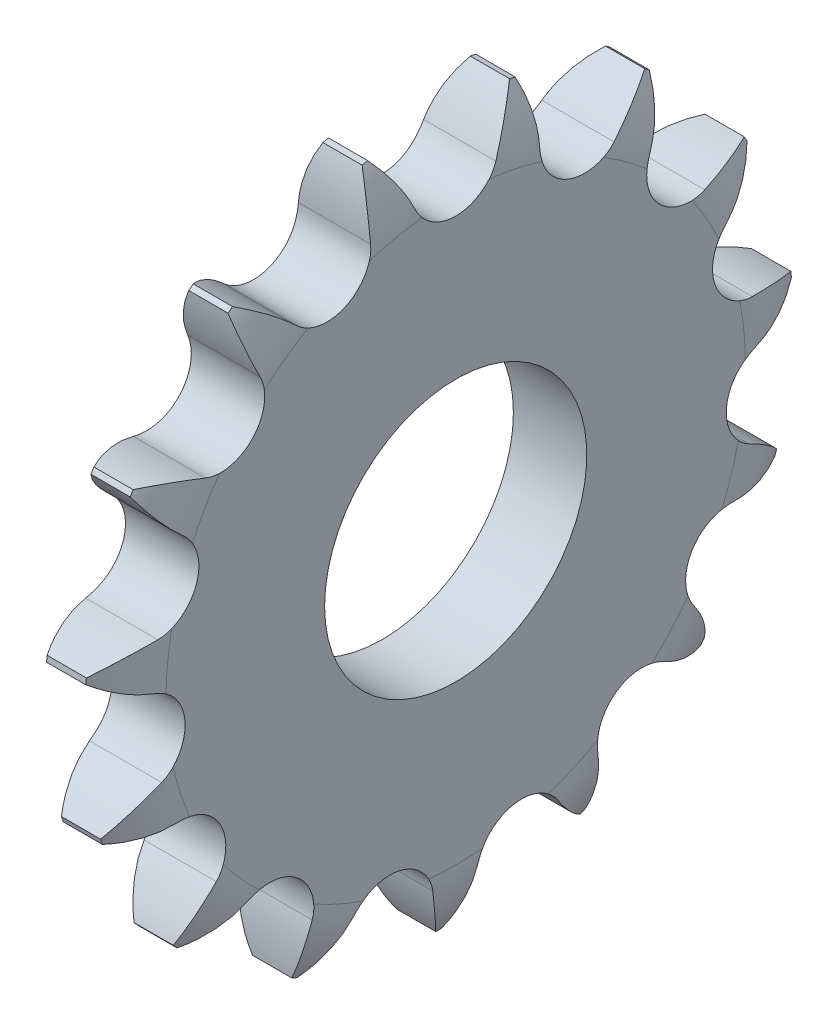
from build123d import *

# Parameters (mm, degrees)
TOOTHCUT_DEPTH  = 37.710811315
TEETHCUTS_COUNT = 15
TEETHCUTS_ANGLE = 336
BORSKE_R        = 9.5
BORE_DEPTH      = 50.0005


with BuildPart() as part:
    # BasProSke → Base-Revolve (revolve)
    with BuildSketch(Plane(origin=(0, 0, 0), x_dir=(1, 0, 0), z_dir=(0, 1, 0)), mode=Mode.PRIVATE) as base_revolve_sk:
        with BuildLine():
            Line((0, 0), (0, 20.988608354))
            ThreePointArc((0, 20.988608354), (0.314698702, 23.416771239), (1.238, 25.684484843))
            Line((1.238, 25.684484843), (4.0816, 25.684484843))
            ThreePointArc((4.0816, 25.684484843), (5.004901298, 23.416771239), (5.3196, 20.988608354))
            Line((5.3196, 20.988608354), (5.3196, 0))
            Line((5.3196, 0), (0, 0))
        make_face()
    revolve(base_revolve_sk.sketch.rotate(Axis((-10, 0, 0), (1, 0, 0)), 180), axis=Axis((-10, 0, 0), (1, 0, 0)))

    # TooCutSke → ToothCut (cut, through all)
    with BuildSketch(Plane(origin=(0, 0, 0), x_dir=(0, 0, -1), z_dir=(1, 0, 0))):
        with BuildLine():
            ThreePointArc((2.951828939, 21.685132796), (4.063020217, 23.756940993), (5.530366998, 25.593793922))
            ThreePointArc((5.530366998, 25.593793922), (0, 26.184484843), (-5.530366998, 25.593793922))
            ThreePointArc((-5.530366998, 25.593793922), (-4.063020217, 23.756940993), (-2.951828939, 21.685132796))
            ThreePointArc((-2.951828939, 21.685132796), (0, 19.731359843), (2.951828939, 21.685132796))
        make_face()
    toothcut = extrude(amount=TOOTHCUT_DEPTH, mode=Mode.SUBTRACT)

    # TeethCuts: ToothCut ×15 about axis
    teethcuts_axis = Axis((-10, 0, 0), (1, 0, 0))
    for i in range(1, TEETHCUTS_COUNT):
        add(toothcut.rotate(teethcuts_axis, i * TEETHCUTS_ANGLE / (TEETHCUTS_COUNT - 1)), mode=Mode.SUBTRACT)

    # BorSke → Bore (cut, symmetric)
    with BuildSketch(Plane(origin=(0, 0, 0), x_dir=(0, 0, -1), z_dir=(1, 0, 0))):
        with Locations(Location((0, 0, 0), (0, 0, 180))):
            Circle(BORSKE_R)
    extrude(amount=BORE_DEPTH, both=True, mode=Mode.SUBTRACT)


solid = part.part
